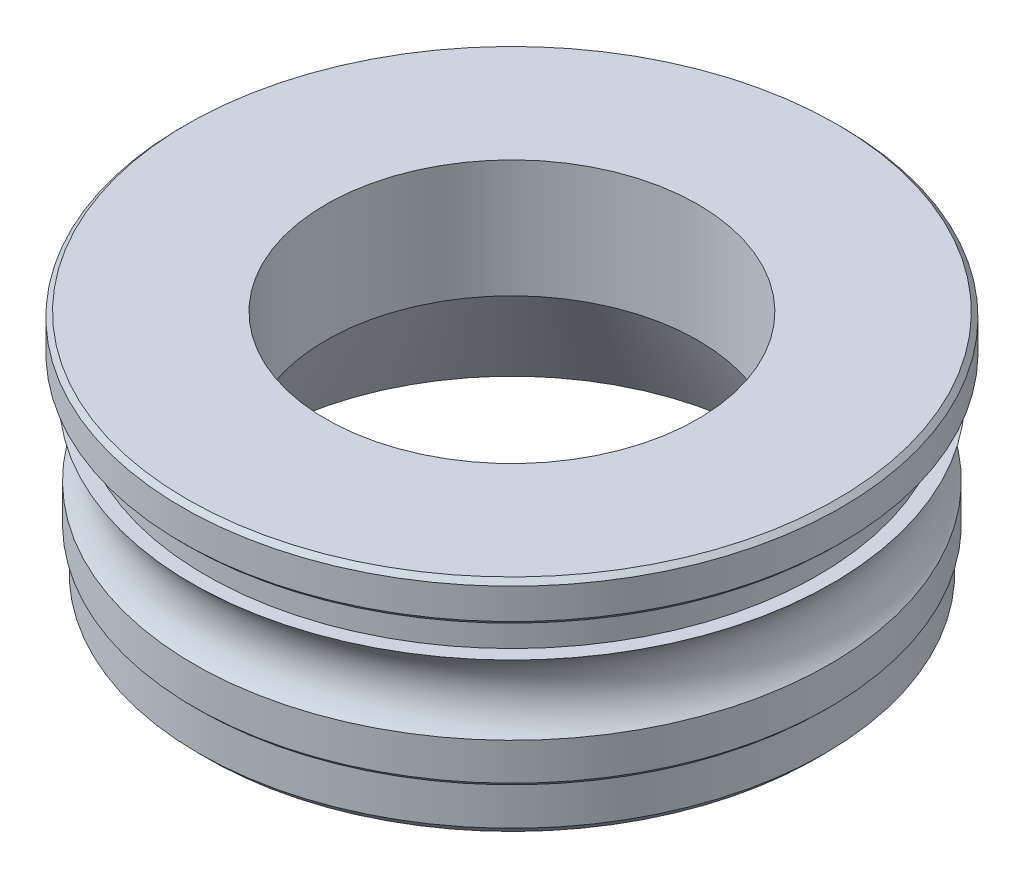
from build123d import *


with BuildPart() as part:
    # Croquis1 → Revolución1 (revolve)
    with BuildSketch(Plane.XY, mode=Mode.PRIVATE) as revoluci_n1_sk:
        with BuildLine():
            Line((6.45, 0), (6.65, 0.2))
            Line((6.65, 0.2), (6.65, 1))
            Line((6.65, 1), (6.75, 1.1))
            Line((6.75, 1.1), (6.75, 1.767))
            Line((6.75, 1.767), (6.75, 1.889))
            ThreePointArc((6.75, 1.889), (6.429860393, 2.6559209), (6.8, 3.4))
            Line((6.8, 3.4), (6.5, 3.4))
            Line((6.5, 3.4), (6.5, 4.15))
            Line((6.5, 4.15), (6.9, 4.15))
            Line((6.9, 4.15), (7, 4.25))
            Line((7, 4.25), (7, 4.9))
            Line((7, 4.9), (6.9, 5))
            Line((6.9, 5), (3.95, 5))
            Line((3.95, 5), (3.95, 2.5))
            Line((3.95, 2.5), (5.393375673, 0))
            Line((5.393375673, 0), (6.45, 0))
        make_face()
    revolve(revoluci_n1_sk.sketch.rotate(Axis((0, 0, 0), (0, 1, 0)), 90), axis=Axis((0, 0, 0), (0, 1, 0)))


solid = part.part
